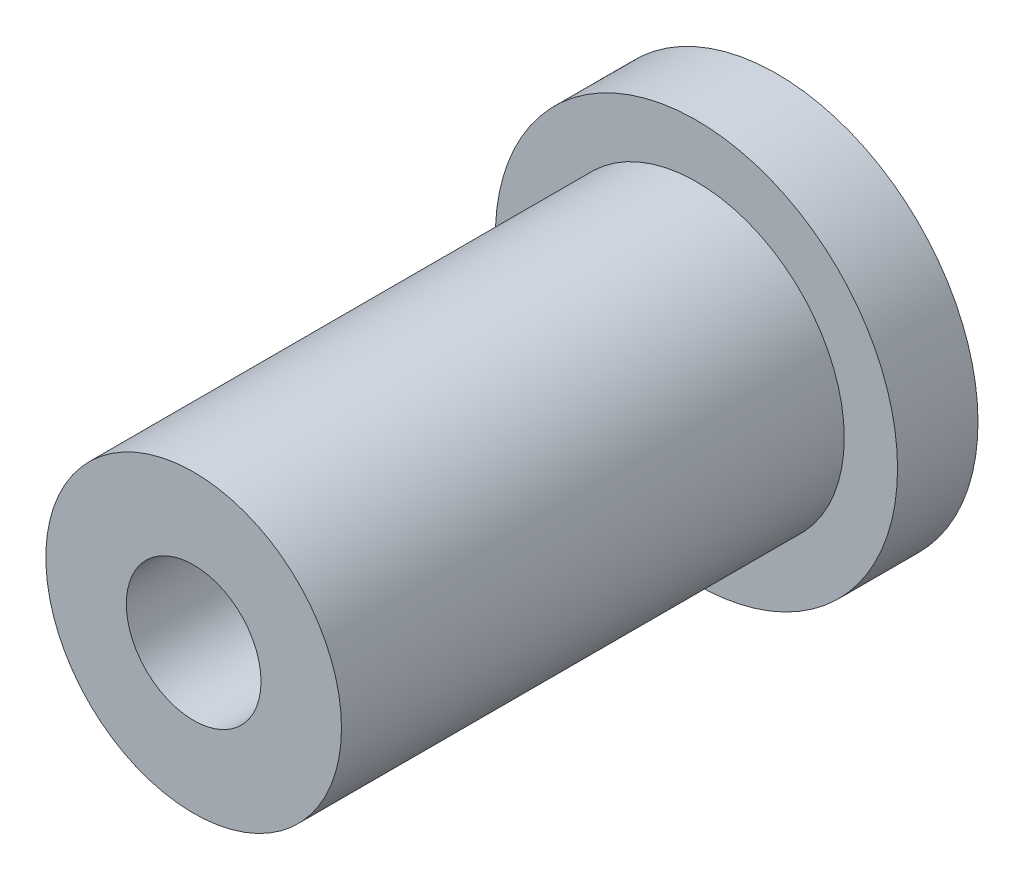
from build123d import *

# Parameters (mm, degrees)
SKETCH_1_R      = 10
SKETCH_1_R_2    = 4
EXTRUDE_1_DEPTH = 4
SKETCH_2_R      = 7.35
SKETCH_2_R_2    = 3.35
EXTRUDE_2_DEPTH = 25


with BuildPart() as part:
    # 草图1 → 拉伸-薄壁1 (new body)
    with BuildSketch(Plane.XY):
        Circle(SKETCH_1_R)
        Circle(SKETCH_1_R_2, mode=Mode.SUBTRACT)
    extrude(amount=EXTRUDE_1_DEPTH)

    # 草图2 → 拉伸-薄壁2 (add)
    with BuildSketch(Plane.XY.offset(4)):
        Circle(SKETCH_2_R)
        Circle(SKETCH_2_R_2, mode=Mode.SUBTRACT)
    extrude(amount=EXTRUDE_2_DEPTH)


solid = part.part
